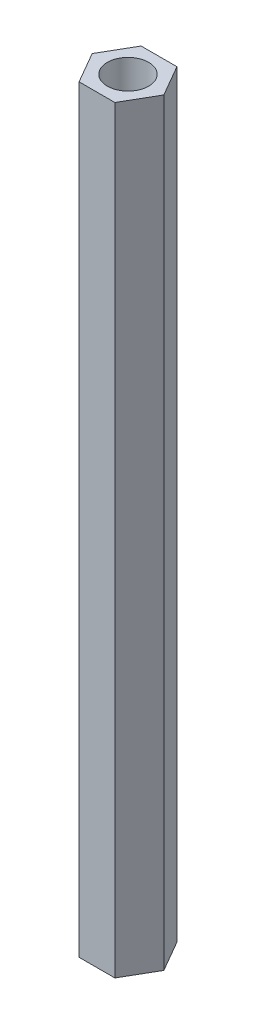
from build123d import *

# Parameters (mm, degrees)
SKETCH1_R           = 1.5
BOSS_EXTRUDE1_DEPTH = 55


with BuildPart() as part:
    # Sketch1 → Boss-Extrude1 (new body)
    with BuildSketch(Plane(origin=(0, 0, 0), x_dir=(1, 0, 0), z_dir=(0, 1, 0))):
        Polygon((2.598076211, 0), (1.299038106, 2.25), (-1.299038106, 2.25), (-2.598076211, 0), (-1.299038106, -2.25), (1.299038106, -2.25), align=None)
        with Locations(Location((0, 0, 0), (0, 0, 270))):
            Circle(SKETCH1_R, mode=Mode.SUBTRACT)
    extrude(amount=BOSS_EXTRUDE1_DEPTH)


solid = part.part
